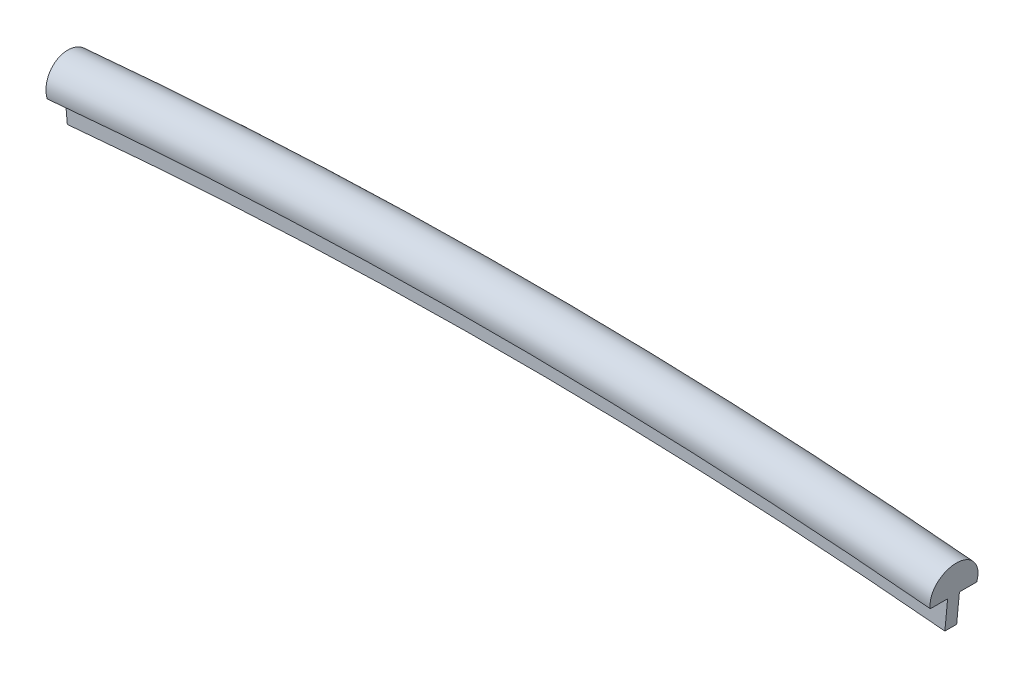
from build123d import *

# Parameters (mm, degrees)
REVOLVE1_ANGLE           = 5.338983384
REVOLVE1_OTHER_WAY_ANGLE = 5.338983384


with BuildPart() as part:
    # Sketch2 → Revolve1 (revolve)
    with BuildSketch(Plane(origin=(0, 0, 0), x_dir=(0, 0, -1), z_dir=(1, 0, 0))):
        with BuildLine():
            Line((0, 239.8), (0.3, 239.8))
            Line((0.3, 239.8), (0.3, 241.3))
            Line((0.3, 241.3), (1.18, 241.3))
            ThreePointArc((1.18, 241.3), (0, 242.800182019), (-1.18, 241.3))
            Line((-1.18, 241.3), (-0.3, 241.3))
            Line((-0.3, 241.3), (-0.3, 239.8))
            Line((-0.3, 239.8), (0, 239.8))
        make_face()
    revolve(axis=Axis((0, 0, 70.597641597), (0, 0, -1)), revolution_arc=REVOLVE1_ANGLE)

    # Sketch2 → Revolve1 other way (revolve)
    with BuildSketch(Plane(origin=(0, 0, 0), x_dir=(0, 0, -1), z_dir=(1, 0, 0))):
        with BuildLine():
            Line((0, 239.8), (0.3, 239.8))
            Line((0.3, 239.8), (0.3, 241.3))
            Line((0.3, 241.3), (1.18, 241.3))
            ThreePointArc((1.18, 241.3), (0, 242.800182019), (-1.18, 241.3))
            Line((-1.18, 241.3), (-0.3, 241.3))
            Line((-0.3, 241.3), (-0.3, 239.8))
            Line((-0.3, 239.8), (0, 239.8))
        make_face()
    revolve(axis=Axis((0, 0, 70.597641597), (0, 0, 1)), revolution_arc=REVOLVE1_OTHER_WAY_ANGLE)


solid = part.part
